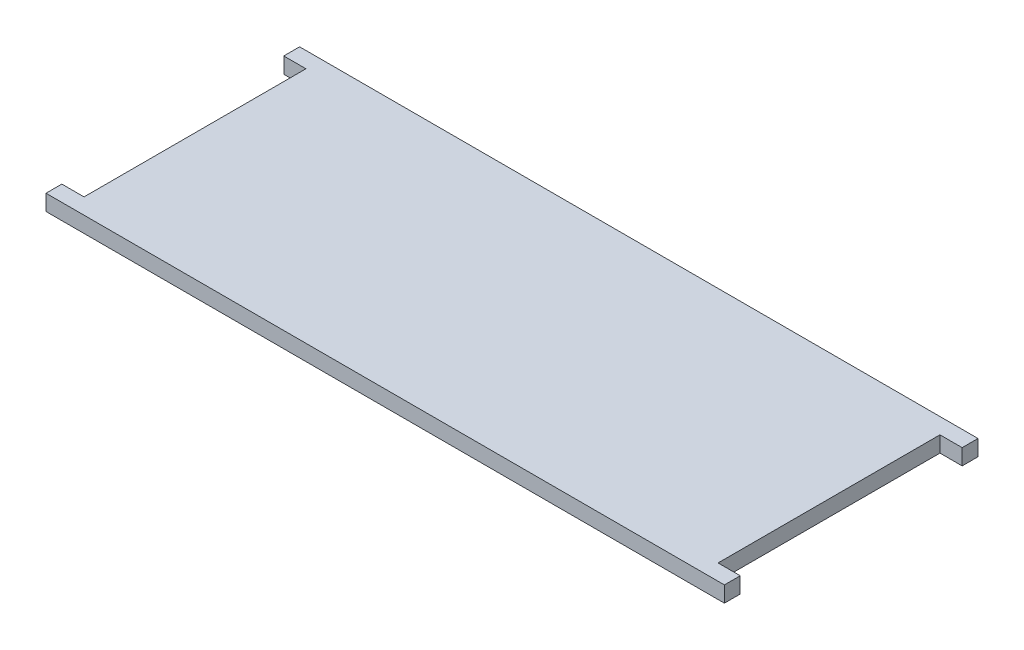
from build123d import *

# Parameters (mm, degrees)
SKETCH1_W           = 127
SKETCH1_H           = 50.8
SKETCH1_W_2         = 4.445
SKETCH1_H_2         = 3.175
BOSS_EXTRUDE1_DEPTH = 3.175


with BuildPart() as part:
    # Sketch1 → Boss-Extrude1 (new body)
    with BuildSketch(Plane(origin=(0, 0, 0), x_dir=(1, 0, 0), z_dir=(0, 1, 0))):
        Rectangle(SKETCH1_W, SKETCH1_H)
        with Locations((-65.7225, 23.8125)):
            Rectangle(SKETCH1_W_2, SKETCH1_H_2)
        with Locations((-65.7225, -23.8125)):
            Rectangle(SKETCH1_W_2, SKETCH1_H_2)
        with Locations((65.7225, -23.8125)):
            Rectangle(SKETCH1_W_2, SKETCH1_H_2)
        with Locations((65.7225, 23.8125)):
            Rectangle(SKETCH1_W_2, SKETCH1_H_2)
    extrude(amount=BOSS_EXTRUDE1_DEPTH)


solid = part.part
